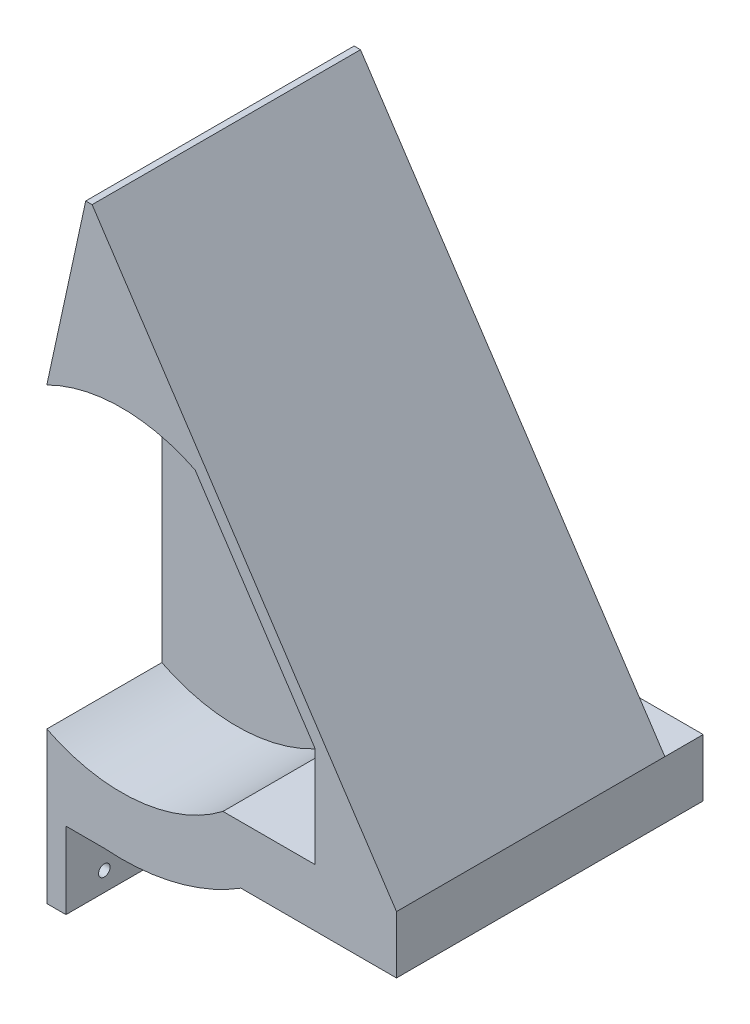
from build123d import *

# Parameters (mm, degrees)
EXTRUDE_1_DEPTH           = 30
EXTRUDE_2_DEPTH           = 210
SKETCH_8_W                = 25
SKETCH_8_H                = 120
EXTRUDE_5_DEPTH           = 70
SKETCH_9_W                = 25
SKETCH_9_H                = 60
EXTRUDE_6_DEPTH           = 60
SKETCH_10_R               = 7.5
CUT_EXTRUDE_3_DEPTH       = 402.372644808
EXTRUDE_7_DEPTH           = 60
EXTRUDE_8_REACH           = 392.16
SKETCH_12_R               = 2.5
SKETCH_14_W               = 125
SKETCH_14_H               = 50
EXTRUDE_9_DEPTH           = 120
SKETCH_15_W               = 70
SKETCH_15_H               = 70
CUT_EXTRUDE_4_DEPTH       = 10
CUT_EXTRUDE_5_DEPTH       = 20
SKETCH_17_R               = 43.471266984
CUT_EXTRUDE_6_DEPTH       = 428.317212384
EXTRUDE_10_DEPTH          = 20
EXTRUDE_11_DEPTH          = 20
CUT_EXTRUDE_7_DEPTH       = 434.012701892
CUT_EXTRUDE_8_DEPTH       = 434.012701892
EXTRUDE_19_REACH          = 446.86
EXTRUDE_20_DEPTH          = 20
EXTRUDE_21_DEPTH          = 20
EXTRUDE_START             = 20
EXTRUDE_22_DEPTH          = 20
CUT_EXTRUDE_9_DEPTH       = 30
CUT_EXTRUDE_11_DEPTH      = 407.201920232
CUT_EXTRUDE_11_DEPTH_BACK = 407.201920232
SKETCH_29_R               = 15
EXTRUDE_23_DEPTH          = 78.203243
SKETCH_33_W               = 30
SKETCH_33_H               = 40
CUT_EXTRUDE_14_DEPTH      = 20
SKETCH_34_W               = 18
SKETCH_34_H               = 35.300600551
CUT_EXTRUDE_15_DEPTH      = 10
CUT_EXTRUDE_16_DEPTH      = 10
SKETCH_36_RX              = 24.05
SKETCH_36_RY              = 15.9
SKETCH_36_R               = 15.9
CUT_EXTRUDE_17_DEPTH      = 4
SKETCH_37_W               = 148.788525811
SKETCH_37_H               = 80
CUT_EXTRUDE_18_DEPTH      = 445.859528391
SKETCH_38_W               = 76.211474189
SKETCH_38_H               = 51.3
CUT_EXTRUDE_20_DEPTH      = 80
CUT_EXTRUDE_START         = -81
CUT_EXTRUDE_21_DEPTH      = 81
CUT_EXTRUDE_22_DEPTH      = 402.372644808
SKETCH_41_W               = 18
SKETCH_41_H               = 10
CUT_EXTRUDE_23_DEPTH      = 60
SKETCH_44_W               = 50
SKETCH_44_H               = 109
EXTRUDE_26_DEPTH          = 15
SKETCH_45_W               = 50
SKETCH_45_H               = 109
EXTRUDE_27_DEPTH          = 15
EXTRUDE_28_DEPTH          = 15
SKETCH_47_W               = 15
SKETCH_47_H               = 50.339258453
CUT_EXTRUDE_24_DEPTH      = 109
CUT_EXTRUDE_25_DEPTH      = 445.859528391
CUT_EXTRUDE_26_DEPTH      = 15
SKETCH_50_W               = 5
SKETCH_50_H               = 80
EXTRUDE_29_DEPTH          = 20
SKETCH_51_R               = 1.5
CUT_EXTRUDE_27_DEPTH      = 20
EXTRUDE_30_DEPTH          = 20
EXTRUDE_31_DEPTH          = 10
SKETCH_54_R               = 1.5
CUT_EXTRUDE_28_DEPTH      = 10


with BuildPart() as part:
    # 草图1 → 凸台-拉伸1 (new body)
    with BuildSketch(Plane(origin=(0, 0, 0), x_dir=(0, 0, -1), z_dir=(1, 0, 0))):
        with BuildLine():
            Line((0, 0), (270, 0))
            Line((270, 0), (270, -100.282814983))
            ThreePointArc((270, -100.282814983), (264.178138298, -118.691056762), (248.830033233, -130.404003019))
            Line((248.830033233, -130.404003019), (142.45524498, -168.69892679))
            ThreePointArc((142.45524498, -168.69892679), (135, -170), (127.54475502, -168.69892679))
            Line((127.54475502, -168.69892679), (21.169966767, -130.404003019))
            ThreePointArc((21.169966767, -130.404003019), (5.821861702, -118.691056762), (0, -100.282814983))
            Line((0, -100.282814983), (0, 0))
        make_face()
    extrude(amount=EXTRUDE_1_DEPTH)

    # 草图2 → 凸台-拉伸2 (add)
    with BuildSketch(Plane(origin=(30, 0, 0), x_dir=(0, 0, -1), z_dir=(1, 0, 0))):
        with BuildLine():
            Line((105, -160.582814983), (105, 0))
            Line((105, 0), (0, 0))
            Line((0, 0), (0, -100.282814983))
            ThreePointArc((0, -100.282814983), (5.821861702, -118.691056762), (21.169966767, -130.404003019))
            Line((21.169966767, -130.404003019), (105, -160.582814983))
        make_face()
        with BuildLine():
            Line((270, 0), (165, 0))
            Line((165, 0), (165, -160.582814983))
            Line((165, -160.582814983), (248.830033233, -130.404003019))
            ThreePointArc((248.830033233, -130.404003019), (264.178138298, -118.691056762), (270, -100.282814983))
            Line((270, -100.282814983), (270, 0))
        make_face()
    extrude(amount=EXTRUDE_2_DEPTH)

    # 草图8 → 凸台-拉伸5 (add)
    with BuildSketch(Plane(origin=(240, 0, 0), x_dir=(0, 0, -1), z_dir=(1, 0, 0))):
        with Locations((92.5, 0)):
            Rectangle(SKETCH_8_W, SKETCH_8_H)
        with Locations((177.5, 0)):
            Rectangle(SKETCH_8_W, SKETCH_8_H)
    extrude(amount=EXTRUDE_5_DEPTH)

    # 草图9 → 凸台-拉伸6 (add)
    with BuildSketch(Plane.ZY.offset(-240)):
        with Locations((-92.5, 30)):
            Rectangle(SKETCH_9_W, SKETCH_9_H)
        with Locations((-177.5, 30)):
            Rectangle(SKETCH_9_W, SKETCH_9_H)
    extrude(amount=EXTRUDE_6_DEPTH)

    # 草图10 → 切除-拉伸3 (cut, through all)
    with BuildSketch(Plane.XY.offset(-80)):
        with Locations((270, 30)):
            Circle(SKETCH_10_R)
    extrude(amount=-CUT_EXTRUDE_3_DEPTH, mode=Mode.SUBTRACT)

    # 草图11 → 凸台-拉伸7 (add)
    with BuildSketch(Plane(origin=(0, 0, -105), x_dir=(-1, 0, 0), z_dir=(0, 0, -1))):
        with BuildLine():
            Line((-30, -40), (-30, -160.582814983))
            Line((-30, -160.582814983), (-108.203242822, -160.582814983))
            ThreePointArc((-108.203242822, -160.582814983), (-60.24964282, -106.032303748), (-30, -40))
        make_face()
    extrude(amount=EXTRUDE_7_DEPTH)

    # 草图12 → 凸台-拉伸8 (add, up to next)
    with BuildSketch(Plane.XY.offset(-165), mode=Mode.PRIVATE) as extrude_8_sk1:
        with Locations(Location((70, -45, 0), (0, 0, 180))):
            Circle(SKETCH_12_R)
    extrude_8_tool1 = extrude(extrude_8_sk1.sketch, amount=EXTRUDE_8_REACH, mode=Mode.PRIVATE) - part.part
    add(extrude_8_tool1.solids().sort_by_distance((70, -45, -165))[0])

    # 草图14 → 凸台-拉伸9 (add)
    with BuildSketch(Plane(origin=(0, 0, 0), x_dir=(1, 0, 0), z_dir=(0, 1, 0))):
        with Locations((62.5, 225)):
            Rectangle(SKETCH_14_W, SKETCH_14_H)
        with Locations((62.5, 45)):
            Rectangle(SKETCH_14_W, SKETCH_14_H)
    extrude(amount=EXTRUDE_9_DEPTH)

    # 草图15 → 切除-拉伸4 (cut)
    with BuildSketch(Plane.XY.offset(-20)):
        with Locations((35, 35)):
            Rectangle(SKETCH_15_W, SKETCH_15_H)
    extrude(amount=-CUT_EXTRUDE_4_DEPTH, mode=Mode.SUBTRACT)

    # 草图16 → 切除-拉伸5 (cut)
    with BuildSketch(Plane.XY.offset(-30)):
        Polygon((35, 15), (5, 15), (5, 55), (35, 55), (35, 35), align=None)
    extrude(amount=-CUT_EXTRUDE_5_DEPTH, mode=Mode.SUBTRACT)

    # 草图17 → 切除-拉伸6 (cut, through all)
    with BuildSketch(Plane.XY.offset(-30)):
        with Locations((19.5, 34.5)):
            Circle(SKETCH_17_R)
    extrude(amount=CUT_EXTRUDE_6_DEPTH, mode=Mode.SUBTRACT)

    # 草图18 → 凸台-拉伸10 (add)
    with BuildSketch(Plane.XY.offset(-20)):
        Polygon((11.819921283, 120), (91.211474189, 0), (87.317867735, 0), (10.741661946, 115.744614613), align=None)
    extrude(amount=EXTRUDE_10_DEPTH)

    # 草图19 → 凸台-拉伸11 (add)
    with BuildSketch(Plane.XY.offset(-20)):
        with BuildLine():
            Line((1.857343832, 74.230186717), (10.856035233, 115.571739869))
            Line((10.856035233, 115.571739869), (10.741661946, 115.744614613))
            Line((10.741661946, 115.744614613), (11.819921283, 120))
            Line((11.819921283, 120), (10.153664863, 120))
            Line((10.153664863, 120), (0, 73.352297914))
            ThreePointArc((0, 73.352297914), (0.923485284, 73.80221564), (1.857343832, 74.230186717))
        make_face()
    extrude(amount=EXTRUDE_11_DEPTH)

    # 草图20 → 切除-拉伸7 (cut, through all)
    with BuildSketch(Plane.XY.offset(-20)):
        Polygon((0, 120), (0, 73.352297914), (10.153664863, 120), align=None)
    extrude(amount=-CUT_EXTRUDE_7_DEPTH, mode=Mode.SUBTRACT)

    # 草图22 → 切除-拉伸8 (cut, through all)
    with BuildSketch(Plane.XY.offset(-20)):
        Polygon((44.899734993, 70), (70, 32.061054476), (91.211474189, 0), (125, 0), (125, 120), (11.819921283, 120), align=None)
    extrude(amount=-CUT_EXTRUDE_8_DEPTH, mode=Mode.SUBTRACT)

    # 草图23 → 凸台-拉伸19 (add, up to next)
    with BuildSketch(Plane.XY, mode=Mode.PRIVATE) as extrude_19_sk1:
        with BuildLine():
            Line((87.317867735, 0), (91.211474189, 0))
            Line((91.211474189, 0), (11.819921283, 120))
            Line((11.819921283, 120), (10.153664863, 120))
            Line((10.153664863, 120), (0, 73.352297914))
            ThreePointArc((0, 73.352297914), (0.923485284, 73.80221564), (1.857343832, 74.230186717))
            Line((1.857343832, 74.230186717), (10.856035233, 115.571739869))
            Line((10.856035233, 115.571739869), (87.317867735, 0))
        make_face()
    extrude_19_tool1 = extrude(extrude_19_sk1.sketch, amount=-EXTRUDE_19_REACH, mode=Mode.PRIVATE) - part.part
    add(extrude_19_tool1.solids().sort_by_distance((89.264671, 1.5073, 0))[0])

    # 草图24 → 凸台-拉伸20 (add)
    with BuildSketch(Plane.XY.offset(-20)):
        Polygon((87.317867735, 0), (70, 26.175884614), (70, 0), align=None)
    extrude(amount=EXTRUDE_20_DEPTH)

    # 草图25 → 凸台-拉伸21 (add)
    with BuildSketch(Plane.XY.offset(-20)):
        with BuildLine():
            Line((38.684579851, 73.509011127), (10.856035233, 115.571739869))
            Line((10.856035233, 115.571739869), (1.857343832, 74.230186717))
            ThreePointArc((1.857343832, 74.230186717), (20.351120273, 77.962934179), (38.684579851, 73.509011127))
        make_face()
    extrude(amount=EXTRUDE_21_DEPTH)

    # 草图26 → 凸台-拉伸22 (add)
    with BuildSketch(Plane(origin=(0, 0, -250), x_dir=(-1, 0, 0), z_dir=(0, 0, -1)).offset(EXTRUDE_START)):
        with BuildLine():
            Line((-70, 26.175884614), (-38.684579851, 73.509011127))
            ThreePointArc((-38.684579851, 73.509011127), (-19.323897117, 77.970910285), (0, 73.352297914))
            Line((0, 73.352297914), (-10.153664863, 120))
            Line((-10.153664863, 120), (-11.819921283, 120))
            Line((-11.819921283, 120), (-91.211474189, 0))
            Line((-91.211474189, 0), (-240, 0))
            Line((-240, 0), (-240, -100.282814983))
            Line((-240, -100.282814983), (0, -100.282814983))
            Line((0, -100.282814983), (0, -4.352297914))
            ThreePointArc((0, -4.352297914), (-23.599339693, -8.77755154), (-45.948082222, 0))
            Line((-45.948082222, 0), (-70, 0))
            Line((-70, 0), (-70, 26.175884614))
        make_face()
    extrude(amount=-EXTRUDE_22_DEPTH)

    # 草图27 → 切除-拉伸9 (cut)
    with BuildSketch(Plane(origin=(0, 0, -270), x_dir=(-1, 0, 0), z_dir=(0, 0, -1))):
        with BuildLine():
            Line((-38.684579851, 73.509011127), (-70, 26.175884614))
            Line((-70, 26.175884614), (-70, 0))
            Line((-70, 0), (-45.948082222, 0))
            ThreePointArc((-45.948082222, 0), (-23.599339693, -8.77755154), (0, -4.352297914))
            Line((0, -4.352297914), (0, 73.352297914))
            ThreePointArc((0, 73.352297914), (-19.323897117, 77.970910285), (-38.684579851, 73.509011127))
        make_face()
    extrude(amount=-CUT_EXTRUDE_9_DEPTH, mode=Mode.SUBTRACT)

    # 草图29 → 切除-拉伸11 (cut, two sides: drawn at the far end of the back side and taken through both)
    with BuildSketch(Plane(origin=(0, 0, -70), x_dir=(-1, 0, 0), z_dir=(0, 0, -1)).offset(-CUT_EXTRUDE_11_DEPTH_BACK)):
        with Locations((-20, 35)):
            Circle(SKETCH_29_R)
    extrude(amount=CUT_EXTRUDE_11_DEPTH + CUT_EXTRUDE_11_DEPTH_BACK, mode=Mode.SUBTRACT)

    # 草图30 → 凸台-拉伸23 (add)
    with BuildSketch(Plane(origin=(30, 0, 0), x_dir=(0, 0, -1), z_dir=(1, 0, 0))):
        with BuildLine():
            Line((142.45524498, -168.69892679), (165, -160.582814983))
            Line((165, -160.582814983), (105, -160.582814983))
            Line((105, -160.582814983), (127.54475502, -168.69892679))
            ThreePointArc((127.54475502, -168.69892679), (135, -170), (142.45524498, -168.69892679))
        make_face()
    extrude(amount=EXTRUDE_23_DEPTH)

    # 草图33 → 切除-拉伸14 (cut)
    with BuildSketch(Plane(origin=(0, 0, -240), x_dir=(-1, 0, 0), z_dir=(0, 0, -1))):
        with Locations((-20, 35)):
            Rectangle(SKETCH_33_W, SKETCH_33_H)
    extrude(amount=-CUT_EXTRUDE_14_DEPTH, mode=Mode.SUBTRACT)

    # 草图34 → 切除-拉伸15 (cut)
    with BuildSketch(Plane.XY.offset(-200)):
        with Locations((20, 17.650300276)):
            Rectangle(SKETCH_34_W, SKETCH_34_H)
    extrude(amount=-CUT_EXTRUDE_15_DEPTH, mode=Mode.SUBTRACT)

    # 草图35 → 切除-拉伸16 (cut)
    with BuildSketch(Plane(origin=(0, 0, -70), x_dir=(-1, 0, 0), z_dir=(0, 0, -1))):
        with BuildLine():
            Line((-11, 0), (-11, 23))
            ThreePointArc((-11, 23), (-20, 20), (-29, 23))
            Line((-29, 23), (-29, 0))
            Line((-29, 0), (-11, 0))
        make_face()
    extrude(amount=-CUT_EXTRUDE_16_DEPTH, mode=Mode.SUBTRACT)

    # 草图36 → 切除-拉伸17 (cut)
    # profile 1 of 6: a face of its own
    with BuildSketch(Plane.ZY):
        with Locations((-235.69166945, -100.008005659)):
            Ellipse(SKETCH_36_RX, SKETCH_36_RY)
        with Locations((-235.69166945, -100.008005659)):
            Circle(SKETCH_36_R, mode=Mode.SUBTRACT)
    # profile 2 of 6: a face of its own
    with BuildSketch(Plane.ZY):
        with Locations((-235.69166945, -100.008005659)):
            Ellipse(SKETCH_36_RX, SKETCH_36_RY)
        with Locations((-235.69166945, -100.008005659)):
            Circle(SKETCH_36_R, mode=Mode.SUBTRACT)
    # profile 3 of 6: a face of its own
    with BuildSketch(Plane.ZY):
        with Locations((-235.69166945, -100.008005659)):
            Circle(SKETCH_36_R)
    # profile 4 of 6: a face of its own
    with BuildSketch(Plane.ZY):
        with Locations(Location((-34.30833055, -100.008005659), (0, 0, 180))):
            Ellipse(SKETCH_36_RX, SKETCH_36_RY)
        with Locations((-34.30833055, -100.008005659)):
            Circle(SKETCH_36_R, mode=Mode.SUBTRACT)
    # profile 5 of 6: a face of its own
    with BuildSketch(Plane.ZY):
        with Locations(Location((-34.30833055, -100.008005659), (0, 0, 180))):
            Ellipse(SKETCH_36_RX, SKETCH_36_RY)
        with Locations((-34.30833055, -100.008005659)):
            Circle(SKETCH_36_R, mode=Mode.SUBTRACT)
    # profile 6 of 6: a face of its own
    with BuildSketch(Plane.ZY):
        with Locations((-34.30833055, -100.008005659)):
            Circle(SKETCH_36_R)
    extrude(amount=-CUT_EXTRUDE_17_DEPTH, mode=Mode.SUBTRACT)

    # 草图37 → 切除-拉伸18 (cut, through all)
    with BuildSketch(Plane(origin=(0, 0, 0), x_dir=(1, 0, 0), z_dir=(0, 1, 0))):
        with Locations((165.605737095, 40)):
            Rectangle(SKETCH_37_W, SKETCH_37_H)
        with Locations((165.605737095, 230)):
            Rectangle(SKETCH_37_W, SKETCH_37_H)
    extrude(amount=-CUT_EXTRUDE_18_DEPTH, mode=Mode.SUBTRACT)

    # 草图38 → 切除-拉伸20 (cut)
    with BuildSketch(Plane.XY):
        with Locations((53.105737095, -125.932814983)):
            Rectangle(SKETCH_38_W, SKETCH_38_H)
        Polygon((91.211474189, -15), (76.211474189, -15), (76.211474189, -85.282814983), (15, -85.282814983), (15, -100.282814983), (91.211474189, -100.282814983), align=None)
        with BuildLine():
            ThreePointArc((15, -23.79784784), (33.51949079, -22.265684535), (50.622966805, -15))
            Line((50.622966805, -15), (70, -15))
            Line((70, -15), (76.211474189, -15))
            Line((76.211474189, -15), (76.211474189, -85.282814983))
            Line((76.211474189, -85.282814983), (15, -85.282814983))
            Line((15, -85.282814983), (15, -23.79784784))
        make_face()
    extrude(amount=-CUT_EXTRUDE_20_DEPTH, mode=Mode.SUBTRACT)

    # 草图39 → 切除-拉伸21 (cut)
    with BuildSketch(Plane(origin=(0, 0, -270), x_dir=(-1, 0, 0), z_dir=(0, 0, -1)).offset(CUT_EXTRUDE_START)):
        with BuildLine():
            Line((-180, 60), (-310, 60))
            Line((-310, 60), (-310, -60))
            Line((-310, -60), (-240, -60))
            Line((-240, -60), (-240, -151.582814983))
            Line((-240, -151.582814983), (-15, -151.582814983))
            Line((-15, -151.582814983), (-15, -23.79784784))
            ThreePointArc((-15, -23.79784784), (-33.51949079, -22.265684535), (-50.622966805, -15))
            Line((-50.622966805, -15), (-91.211474189, -15))
            Line((-91.211474189, -15), (-91.211474189, 0))
            Line((-91.211474189, 0), (-180, 0))
            Line((-180, 0), (-180, 60))
        make_face()
    extrude(amount=CUT_EXTRUDE_21_DEPTH, mode=Mode.SUBTRACT)

    # 草图40 → 切除-拉伸22 (cut, through all)
    with BuildSketch(Plane.XY.offset(-80)):
        with BuildLine():
            Line((74.655848302, -141.582814983), (40, -141.582814983))
            Line((40, -141.582814983), (40, -91.24355653))
            ThreePointArc((40, -91.24355653), (55.843697078, -117.43499557), (74.655848302, -141.582814983))
        make_face()
    extrude(amount=-CUT_EXTRUDE_22_DEPTH, mode=Mode.SUBTRACT)

    # 草图41 → 切除-拉伸23 (cut)
    with BuildSketch(Plane(origin=(0, 0, 0), x_dir=(1, 0, 0), z_dir=(0, 1, 0))):
        with Locations((20, 65)):
            Rectangle(SKETCH_41_W, SKETCH_41_H)
        with Locations((20, 205)):
            Rectangle(SKETCH_41_W, SKETCH_41_H)
    extrude(amount=-CUT_EXTRUDE_23_DEPTH, mode=Mode.SUBTRACT)

    # 草图44 → 凸台-拉伸26 (add)
    with BuildSketch(Plane(origin=(0, 60, 0), x_dir=(1, 0, 0), z_dir=(0, 1, 0))):
        with Locations((285, 134.5)):
            Rectangle(SKETCH_44_W, SKETCH_44_H)
    extrude(amount=EXTRUDE_26_DEPTH)

    # 草图45 → 凸台-拉伸27 (add)
    with BuildSketch(Plane.XZ.offset(60)):
        with Locations((285, -134.5)):
            Rectangle(SKETCH_45_W, SKETCH_45_H)
    extrude(amount=EXTRUDE_27_DEPTH)

    # 草图46 → 凸台-拉伸28 (add)
    with BuildSketch(Plane(origin=(240, 0, 0), x_dir=(0, 0, -1), z_dir=(1, 0, 0))):
        Polygon((80, -151.582814983), (105, -160.582814983), (165, -160.582814983), (189, -151.942814983), (189, -130.582814983), (80, -130.582814983), align=None)
    extrude(amount=EXTRUDE_28_DEPTH)

    # 草图47 → 切除-拉伸24 (cut)
    with BuildSketch(Plane(origin=(0, 0, -189), x_dir=(-1, 0, 0), z_dir=(0, 0, -1))):
        with Locations((-32.5, -116.413185757)):
            Rectangle(SKETCH_47_W, SKETCH_47_H)
    extrude(amount=-CUT_EXTRUDE_24_DEPTH, mode=Mode.SUBTRACT)

    # 草图48 → 切除-拉伸25 (cut, through all)
    with BuildSketch(Plane(origin=(310, 0, 0), x_dir=(0, 0, -1), z_dir=(1, 0, 0))):
        Polygon((270, 120), (80, 120), (80, -151.582814983), (80, -184.430780579), (270, -184.430780579), (270, -151.582814983), align=None)
    extrude(amount=-CUT_EXTRUDE_25_DEPTH, mode=Mode.SUBTRACT)

    # 草图49 → 切除-拉伸26 (cut)
    with BuildSketch(Plane.ZY):
        with BuildLine():
            Line((-70, -23.79784784), (-60, -23.79784784))
            Line((-60, -23.79784784), (0, -23.79784784))
            Line((0, -23.79784784), (0, -100.282814983))
            ThreePointArc((0, -100.282814983), (-5.821861702, -118.691056762), (-21.169966767, -130.404003019))
            Line((-21.169966767, -130.404003019), (-80, -151.582814983))
            Line((-80, -151.582814983), (-80, -23.79784784))
            Line((-80, -23.79784784), (-70, -23.79784784))
        make_face()
    extrude(amount=-CUT_EXTRUDE_26_DEPTH, mode=Mode.SUBTRACT)

    # 草图50 → 凸台-拉伸29 (add)
    with BuildSketch(Plane.XZ.offset(23.79784784)):
        with Locations((2.5, -40)):
            Rectangle(SKETCH_50_W, SKETCH_50_H)
    extrude(amount=EXTRUDE_29_DEPTH)

    # 草图51 → 切除-拉伸27 (cut)
    with BuildSketch(Plane(origin=(5, 0, 0), x_dir=(0, 0, -1), z_dir=(1, 0, 0))):
        with Locations((70, -38.79784784)):
            Circle(SKETCH_51_R)
        with Locations((10, -38.79784784)):
            Circle(SKETCH_51_R)
    extrude(amount=-CUT_EXTRUDE_27_DEPTH, mode=Mode.SUBTRACT)

    # 草图52 → 凸台-拉伸30 (add)
    with BuildSketch(Plane.XY.offset(-30)):
        Polygon((35, 35), (35, 55), (5, 55), (5, 35), (5, 15), (35, 15), align=None)
    extrude(amount=-EXTRUDE_30_DEPTH)

    # 草图53 → 凸台-拉伸31 (add)
    with BuildSketch(Plane(origin=(0, 0, -70), x_dir=(-1, 0, 0), z_dir=(0, 0, -1))):
        with BuildLine():
            ThreePointArc((-29, 23), (-20, 20), (-11, 23))
            ThreePointArc((-11, 23), (-6.583592135, 28.291796068), (-5, 35))
            ThreePointArc((-5, 35), (-26.708203932, 48.416407865), (-29, 23))
        make_face()
        with BuildLine():
            ThreePointArc((-29, -23.19435902), (-22.018144096, -23.91701818), (-15, -23.79784784))
            Line((-15, -23.79784784), (-11, -23.79784784))
            Line((-11, -23.79784784), (-11, 0))
            Line((-11, 0), (-11, 23))
            ThreePointArc((-11, 23), (-20, 20), (-29, 23))
            Line((-29, 23), (-29, 0))
            Line((-29, 0), (-29, -23.19435902))
        make_face()
    extrude(amount=-EXTRUDE_31_DEPTH)

    # 草图54 → 切除-拉伸28 (cut)
    with BuildSketch(Plane(origin=(0, 0, -80), x_dir=(-1, 0, 0), z_dir=(0, 0, -1))):
        with Locations((-76.211474189, -7.5)):
            Circle(SKETCH_54_R)
        with Locations((-15, -7.5)):
            Circle(SKETCH_54_R)
    extrude(amount=-CUT_EXTRUDE_28_DEPTH, mode=Mode.SUBTRACT)


solid = part.part
